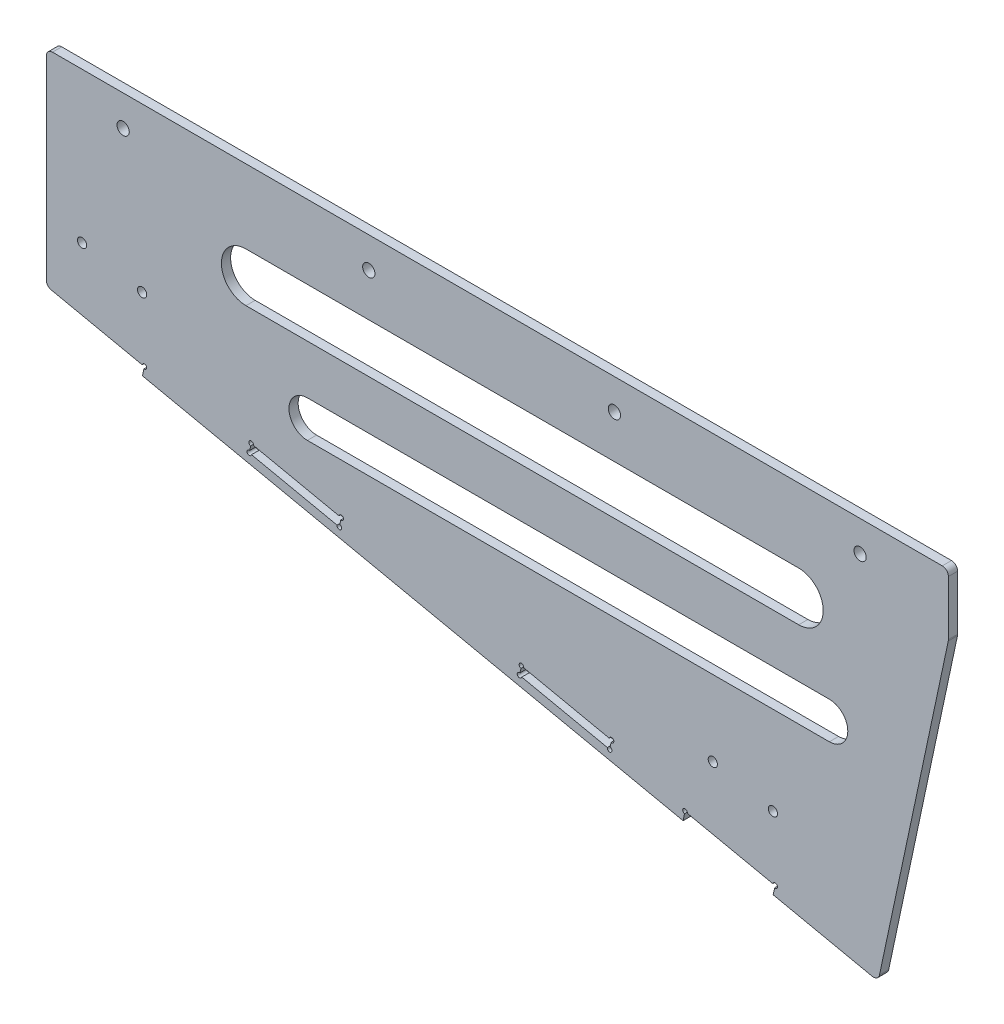
from build123d import *

# Parameters (mm, degrees)
EXTRUDE_1_DEPTH      = 3
CUT_EXTRUDE_2_DEPTH  = 10
SKETCH_4_R           = 1.5
CUT_EXTRUDE_3_DEPTH  = 10
CUT_EXTRUDE_6_DEPTH  = 327.235911434
SKETCH_12_W          = 293.771267283
SKETCH_12_H          = 20
EXTRUDE_2_DEPTH      = 3
SKETCH_13_R          = 2
CUT_EXTRUDE_9_DEPTH  = 278.623703749
CUT_EXTRUDE_10_DEPTH = 10
MM_2_D               = 1.5
CUT_EXTRUDE_11_DEPTH = 278.623703749
MM_3_D               = 1.5
FILLET_1_R           = 2


with BuildPart() as part:
    # 草图1 → 凸台-拉伸1 (new body)
    with BuildSketch(Plane.XY):
        Polygon((-31.770103996, 71.767703031), (318.229896004, 71.767703031), (292.931935015, -47.249845949), (-31.770103996, 21.767703031), align=None)
    extrude(amount=EXTRUDE_1_DEPTH)

    # 草图3 → 切除-拉伸2 (cut)
    with BuildSketch(Plane.XY.offset(3)):
        Polygon((-0.469380772, 15.114528924), (0.1543543, 18.048971727), (-31.770103996, 24.834724815), (-31.770103996, 21.767703031), align=None)
        Polygon((176.220922432, -19.375132621), (205.565350454, -25.612483345), (204.941615382, -28.546926147), (175.59718736, -22.309575423), align=None)
    extrude(amount=-CUT_EXTRUDE_2_DEPTH, mode=Mode.SUBTRACT)

    # 草图4 → 切除-拉伸3 (cut)
    with BuildSketch(Plane.XY.offset(3)):
        with Locations((-20.141101902, 42.809716012)):
            Circle(SKETCH_4_R)
        with Locations((-0.578149887, 38.651482195)):
            Circle(SKETCH_4_R)
        with Locations((185.269894252, -0.85173906)):
            Circle(SKETCH_4_R)
        with Locations((204.832846267, -5.009972876)):
            Circle(SKETCH_4_R)
    extrude(amount=-CUT_EXTRUDE_3_DEPTH, mode=Mode.SUBTRACT)

    # 草图7 → 切除-拉伸6 (cut, through all)
    with BuildSketch(Plane.XY.offset(3)):
        Polygon((292.931935015, -47.249845949), (239.133816975, -35.814702954), (262.001163287, 71.767703031), (318.229896004, 71.767703031), align=None)
    extrude(amount=-CUT_EXTRUDE_6_DEPTH, mode=Mode.SUBTRACT)

    # 草图12 → 凸台-拉伸2 (add)
    with BuildSketch(Plane.XY.offset(3)):
        with Locations((115.115529646, 81.767703031)):
            Rectangle(SKETCH_12_W, SKETCH_12_H)
    extrude(amount=-EXTRUDE_2_DEPTH)

    # 草图13 → 切除-拉伸9 (cut, through all)
    with BuildSketch(Plane.XY.offset(3)):
        with Locations((-6.770103996, 81.767703031)):
            Circle(SKETCH_13_R)
        with Locations((73.229896004, 81.767703031)):
            Circle(SKETCH_13_R)
        with Locations((153.229896004, 81.767703031)):
            Circle(SKETCH_13_R)
        with Locations((233.229896004, 81.767703031)):
            Circle(SKETCH_13_R)
    extrude(amount=-CUT_EXTRUDE_9_DEPTH, mode=Mode.SUBTRACT)

    # 草图14 → 切除-拉伸10 (cut)
    with BuildSketch(Plane.XY.offset(3)):
        with BuildLine():
            Line((33.229896004, 67.767703031), (213.229896004, 67.767703031))
            ThreePointArc((213.229896004, 67.767703031), (221.229896004, 59.767703031), (213.229896004, 51.767703031))
            Line((213.229896004, 51.767703031), (33.229896004, 51.767703031))
            ThreePointArc((33.229896004, 51.767703031), (25.229896004, 59.767703031), (33.229896004, 67.767703031))
        make_face()
        with BuildLine():
            Line((53.229896004, 35.767703031), (223.229896004, 35.767703031))
            ThreePointArc((223.229896004, 35.767703031), (229.229896004, 29.767703031), (223.229896004, 23.767703031))
            Line((223.229896004, 23.767703031), (53.229896004, 23.767703031))
            ThreePointArc((53.229896004, 23.767703031), (47.229896004, 29.767703031), (53.229896004, 35.767703031))
        make_face()
    extrude(amount=-CUT_EXTRUDE_10_DEPTH, mode=Mode.SUBTRACT)

    # 大小mm 暗销槽口2 (through all)
    with Locations(Plane.XY.offset(3)):
        with Locations((0.1543543, 18.048971727), (176.220922432, -19.375132621), (205.565350454, -25.612483345)):
            Hole(MM_2_D / 2)

    # 草图18 → 切除-拉伸11 (cut, through all)
    with BuildSketch(Plane(origin=(0, 0, 0), x_dir=(-1, 0, 0), z_dir=(0, 0, -1))):
        Polygon((-152.291642964, -11.221785469), (-151.667907892, -14.156228271), (-122.32347987, -7.918877547), (-122.947214942, -4.984434744), align=None)
        Polygon((-64.258358898, 7.490266705), (-63.634623826, 4.555823902), (-34.290195804, 10.793174627), (-34.913930876, 13.727617429), align=None)
    extrude(amount=-CUT_EXTRUDE_11_DEPTH, mode=Mode.SUBTRACT)

    # 大小mm 暗销槽口3 (through all)
    with Locations(Plane(origin=(0, 0, 0), x_dir=(-1, 0, 0), z_dir=(0, 0, -1))):
        with Locations((-152.291642964, -11.221785469), (-151.667907892, -14.156228271), (-122.32347987, -7.918877547), (-122.947214942, -4.984434744), (-64.258358898, 7.490266705), (-63.634623826, 4.555823902), (-34.290195804, 10.793174627), (-34.913930876, 13.727617429)):
            Hole(MM_3_D / 2)

    # 圆角1
    fillet_1_edges = [part.edges().sort_by_distance(p)[0] for p in [
        (-31.770103996, 24.834724815, 1.5),
        (239.133816975, -35.814702954, 1.5),
        (262.001163287, 71.767703031, 1.5),
        (-31.770103996, 91.767703031, 1.5),
        (262.001163287, 91.767703031, 1.5),
    ]]
    fillet(fillet_1_edges, radius=FILLET_1_R)


solid = part.part
